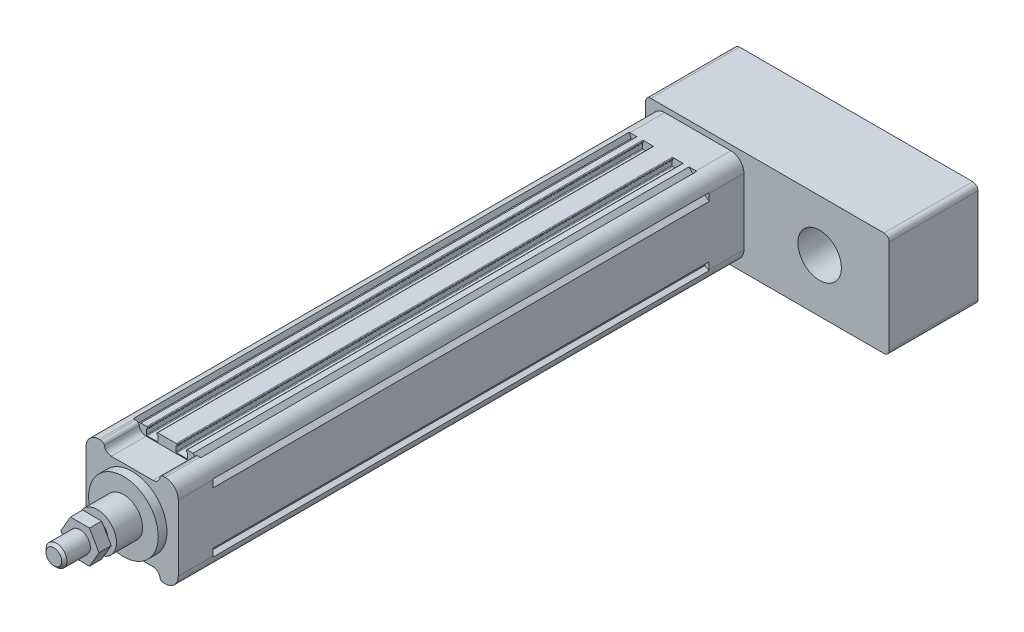
from build123d import *

# Parameters (mm, degrees)
SKETCH_1_R                  = 2.1
EXTRUDE_1_DEPTH             = 285
EXTRUDE_2_DEPTH             = 20
SKETCH_7_R                  = 20
EXTRUDE_3_DEPTH             = 5
SKETCH_9_R                  = 11
EXTRUDE_4_DEPTH             = 15
SKETCH_10_R                 = 6
EXTRUDE_5_DEPTH             = 25
EXTRUDE_START               = 20
EXTRUDE_6_DEPTH             = 20
EXTRUDE_7_DEPTH             = 51
SKETCH_13_R                 = 12.5
CUT_EXTRUDE_2_DEPTH         = 30
PATTERN_LINEAR_1_COUNT      = 2
PATTERN_LINEAR_1_PITCH      = 38
PATTERN_LINEAR_1_COUNT_DIR2 = 2
PATTERN_LINEAR_1_PITCH_DIR2 = 38
HOLE_WIZARD_M6_2_D          = 5
HOLE_WIZARD_M6_2_DEPTH      = 15
HOLE_WIZARD_M6_2_TIP        = 1.502151548
HOLE_WIZARD_M6_3_D          = 5
HOLE_WIZARD_M6_3_DEPTH      = 15
HOLE_WIZARD_M6_3_TIP        = 1.502151548
HOLE_WIZARD_M6_4_D          = 5
HOLE_WIZARD_M6_4_DEPTH      = 15
HOLE_WIZARD_M6_4_TIP        = 1.502151548
CHAMFER_1_SIZE              = 1.5
EXTRUDE_START_2             = 3
EXTRUDE_8_DEPTH             = 7


with BuildPart() as part:
    # 草图1 → 凸台-拉伸1 (new body)
    with BuildSketch(Plane.XY):
        with BuildLine():
            Line((-18.2, 24), (-19.443439638, 26.486879276))
            ThreePointArc((-19.443439638, 26.486879276), (-24.303300859, 24.303300859), (-26.486879276, 19.443439638))
            Line((-26.486879276, 19.443439638), (-24, 18.2))
            Line((-24, 18.2), (-24, 17.1))
            Line((-24, 17.1), (-26.5, 15))
            Line((-26.5, 15), (-26.5, -15))
            Line((-26.5, -15), (-24, -17.1))
            Line((-24, -17.1), (-24, -18.2))
            Line((-24, -18.2), (-26.486879276, -19.443439638))
            ThreePointArc((-26.486879276, -19.443439638), (-24.303300859, -24.303300859), (-19.443439638, -26.486879276))
            Line((-19.443439638, -26.486879276), (-18.2, -24))
            Line((-18.2, -24), (-17.1, -24))
            Line((-17.1, -24), (-15, -26.5))
            Line((-15, -26.5), (-11.65, -26.5))
            ThreePointArc((-11.65, -26.5), (-11.367157288, -26.382842712), (-11.25, -26.1))
            Line((-11.25, -26.1), (-11.25, -25.6))
            ThreePointArc((-11.25, -25.6), (-11.367157288, -25.317157288), (-11.65, -25.2))
            Line((-11.65, -25.2), (-11.75, -25.2))
            Line((-11.75, -25.2), (-11.75, -22.4))
            ThreePointArc((-11.75, -22.4), (-11.632842712, -22.117157288), (-11.35, -22))
            Line((-11.35, -22), (-5.65, -22))
            ThreePointArc((-5.65, -22), (-5.367157288, -22.117157288), (-5.25, -22.4))
            Line((-5.25, -22.4), (-5.25, -25.2))
            Line((-5.25, -25.2), (-5.35, -25.2))
            ThreePointArc((-5.35, -25.2), (-5.632842712, -25.317157288), (-5.75, -25.6))
            Line((-5.75, -25.6), (-5.75, -26.1))
            ThreePointArc((-5.75, -26.1), (-5.632842712, -26.382842712), (-5.35, -26.5))
            Line((-5.35, -26.5), (5.35, -26.5))
            ThreePointArc((5.35, -26.5), (5.632842712, -26.382842712), (5.75, -26.1))
            Line((5.75, -26.1), (5.75, -25.6))
            ThreePointArc((5.75, -25.6), (5.632842712, -25.317157288), (5.35, -25.2))
            Line((5.35, -25.2), (5.25, -25.2))
            Line((5.25, -25.2), (5.25, -22.4))
            ThreePointArc((5.25, -22.4), (5.367157288, -22.117157288), (5.65, -22))
            Line((5.65, -22), (11.35, -22))
            ThreePointArc((11.35, -22), (11.632842712, -22.117157288), (11.75, -22.4))
            Line((11.75, -22.4), (11.75, -25.2))
            Line((11.75, -25.2), (11.65, -25.2))
            ThreePointArc((11.65, -25.2), (11.367157288, -25.317157288), (11.25, -25.6))
            Line((11.25, -25.6), (11.25, -26.1))
            ThreePointArc((11.25, -26.1), (11.367157288, -26.382842712), (11.65, -26.5))
            Line((11.65, -26.5), (15, -26.5))
            Line((15, -26.5), (17.1, -24))
            Line((17.1, -24), (18.2, -24))
            Line((18.2, -24), (19.443439638, -26.486879276))
            ThreePointArc((19.443439638, -26.486879276), (24.303300859, -24.303300859), (26.486879276, -19.443439638))
            Line((26.486879276, -19.443439638), (24, -18.2))
            Line((24, -18.2), (24, -17.1))
            Line((24, -17.1), (26.5, -15))
            Line((26.5, -15), (26.5, 15))
            Line((26.5, 15), (24, 17.1))
            Line((24, 17.1), (24, 18.2))
            Line((24, 18.2), (26.486879276, 19.443439638))
            ThreePointArc((26.486879276, 19.443439638), (24.303300859, 24.303300859), (19.443439638, 26.486879276))
            Line((19.443439638, 26.486879276), (18.2, 24))
            Line((18.2, 24), (17.1, 24))
            Line((17.1, 24), (15, 26.5))
            Line((15, 26.5), (11.65, 26.5))
            ThreePointArc((11.65, 26.5), (11.367157288, 26.382842712), (11.25, 26.1))
            Line((11.25, 26.1), (11.25, 25.6))
            ThreePointArc((11.25, 25.6), (11.367157288, 25.317157288), (11.65, 25.2))
            Line((11.65, 25.2), (11.75, 25.2))
            Line((11.75, 25.2), (11.75, 22.4))
            ThreePointArc((11.75, 22.4), (11.632842712, 22.117157288), (11.35, 22))
            Line((11.35, 22), (5.65, 22))
            ThreePointArc((5.65, 22), (5.367157288, 22.117157288), (5.25, 22.4))
            Line((5.25, 22.4), (5.25, 25.2))
            Line((5.25, 25.2), (5.35, 25.2))
            ThreePointArc((5.35, 25.2), (5.632842712, 25.317157288), (5.75, 25.6))
            Line((5.75, 25.6), (5.75, 26.1))
            ThreePointArc((5.75, 26.1), (5.632842712, 26.382842712), (5.35, 26.5))
            Line((5.35, 26.5), (-5.35, 26.5))
            ThreePointArc((-5.35, 26.5), (-5.632842712, 26.382842712), (-5.75, 26.1))
            Line((-5.75, 26.1), (-5.75, 25.6))
            ThreePointArc((-5.75, 25.6), (-5.632842712, 25.317157288), (-5.35, 25.2))
            Line((-5.35, 25.2), (-5.25, 25.2))
            Line((-5.25, 25.2), (-5.25, 22.4))
            ThreePointArc((-5.25, 22.4), (-5.367157288, 22.117157288), (-5.65, 22))
            Line((-5.65, 22), (-11.35, 22))
            ThreePointArc((-11.35, 22), (-11.632842712, 22.117157288), (-11.75, 22.4))
            Line((-11.75, 22.4), (-11.75, 25.2))
            Line((-11.75, 25.2), (-11.65, 25.2))
            ThreePointArc((-11.65, 25.2), (-11.367157288, 25.317157288), (-11.25, 25.6))
            Line((-11.25, 25.6), (-11.25, 26.1))
            ThreePointArc((-11.25, 26.1), (-11.367157288, 26.382842712), (-11.65, 26.5))
            Line((-11.65, 26.5), (-15, 26.5))
            Line((-15, 26.5), (-17.1, 24))
            Line((-17.1, 24), (-18.2, 24))
        make_face()
        with Locations((19, 19)):
            Circle(SKETCH_1_R, mode=Mode.SUBTRACT)
        with Locations((19, -19)):
            Circle(SKETCH_1_R, mode=Mode.SUBTRACT)
        with Locations((-19, -19)):
            Circle(SKETCH_1_R, mode=Mode.SUBTRACT)
        with Locations((-19, 19)):
            Circle(SKETCH_1_R, mode=Mode.SUBTRACT)
        with BuildLine():
            Line((19.773719933, 3), (23.3, 3))
            Line((23.3, 3), (23.3, -3))
            Line((23.3, -3), (19.773719933, -3))
            ThreePointArc((19.773719933, -3), (0, -20), (-19.773719933, -3))
            Line((-19.773719933, -3), (-23.3, -3))
            Line((-23.3, -3), (-23.3, 3))
            Line((-23.3, 3), (-19.773719933, 3))
            ThreePointArc((-19.773719933, 3), (0, 20), (19.773719933, 3))
        make_face(mode=Mode.SUBTRACT)
    extrude(amount=EXTRUDE_1_DEPTH)

    # 草图6 → 凸台-拉伸2 (add)
    with BuildSketch(Plane.XY.offset(285)):
        with BuildLine():
            Line((-26.5, -19), (-26.5, 19))
            ThreePointArc((-26.5, 19), (-24.303300859, 24.303300859), (-19, 26.5))
            Line((-19, 26.5), (-17.916079783, 26.5))
            ThreePointArc((-17.916079783, 26.5), (-16.625085334, 26.027525232), (-15.944053189, 24.833333333))
            ThreePointArc((-15.944053189, 24.833333333), (-14.581988897, 22.444949537), (-12, 21.5))
            Line((-12, 21.5), (12, 21.5))
            ThreePointArc((12, 21.5), (14.581988897, 22.444949537), (15.944053189, 24.833333333))
            ThreePointArc((15.944053189, 24.833333333), (16.625085334, 26.027525232), (17.916079783, 26.5))
            Line((17.916079783, 26.5), (19, 26.5))
            ThreePointArc((19, 26.5), (24.303300859, 24.303300859), (26.5, 19))
            Line((26.5, 19), (26.5, -19))
            ThreePointArc((26.5, -19), (24.303300859, -24.303300859), (19, -26.5))
            Line((19, -26.5), (17.916079783, -26.5))
            ThreePointArc((17.916079783, -26.5), (16.625085334, -26.027525232), (15.944053189, -24.833333333))
            ThreePointArc((15.944053189, -24.833333333), (14.581988897, -22.444949537), (12, -21.5))
            Line((12, -21.5), (-12, -21.5))
            ThreePointArc((-12, -21.5), (-14.581988897, -22.444949537), (-15.944053189, -24.833333333))
            ThreePointArc((-15.944053189, -24.833333333), (-16.625085334, -26.027525232), (-17.916079783, -26.5))
            Line((-17.916079783, -26.5), (-19, -26.5))
            ThreePointArc((-19, -26.5), (-24.303300859, -24.303300859), (-26.5, -19))
        make_face()
    extrude(amount=EXTRUDE_2_DEPTH)

    # 草图7 → 凸台-拉伸3 (add)
    with BuildSketch(Plane.XY.offset(305)):
        Circle(SKETCH_7_R)
    extrude(amount=EXTRUDE_3_DEPTH)

    # 草图9 → 凸台-拉伸4 (add)
    with BuildSketch(Plane.XY.offset(310)):
        Circle(SKETCH_9_R)
    extrude(amount=EXTRUDE_4_DEPTH)

    # 草图10 → 凸台-拉伸5 (add)
    with BuildSketch(Plane.XY.offset(325)):
        Circle(SKETCH_10_R)
    extrude(amount=EXTRUDE_5_DEPTH)

    # 草图11 → 凸台-拉伸6 (add)
    with BuildSketch(Plane(origin=(0, 0, 0), x_dir=(-1, 0, 0), z_dir=(0, 0, -1)).offset(EXTRUDE_START)):
        with BuildLine():
            Line((-19, -26.5), (19, -26.5))
            ThreePointArc((19, -26.5), (24.303300859, -24.303300859), (26.5, -19))
            Line((26.5, -19), (26.5, 19))
            ThreePointArc((26.5, 19), (24.303300859, 24.303300859), (19, 26.5))
            Line((19, 26.5), (-19, 26.5))
            ThreePointArc((-19, 26.5), (-24.303300859, 24.303300859), (-26.5, 19))
            Line((-26.5, 19), (-26.5, -19))
            ThreePointArc((-26.5, -19), (-24.303300859, -24.303300859), (-19, -26.5))
        make_face()
    extrude(amount=-EXTRUDE_6_DEPTH)

    # 草图12 → 凸台-拉伸7 (add)
    with BuildSketch(Plane(origin=(0, 0, -20), x_dir=(-1, 0, 0), z_dir=(0, 0, -1))):
        with BuildLine():
            Line((-107, -30.404162038), (27, -30.404162038))
            ThreePointArc((27, -30.404162038), (29.121320344, -29.525482382), (30, -27.404162038))
            Line((30, -27.404162038), (30, 26.595837962))
            ThreePointArc((30, 26.595837962), (29.121320344, 28.717158305), (27, 29.595837962))
            Line((27, 29.595837962), (-107, 29.595837962))
            ThreePointArc((-107, 29.595837962), (-109.121320344, 28.717158305), (-110, 26.595837962))
            Line((-110, 26.595837962), (-110, -27.404162038))
            ThreePointArc((-110, -27.404162038), (-109.121320344, -29.525482382), (-107, -30.404162038))
        make_face()
    extrude(amount=EXTRUDE_7_DEPTH)

    # 草图13 → 切除-拉伸2 (cut)
    with BuildSketch(Plane.XY.offset(-20)):
        with Locations((70, 0)):
            Circle(SKETCH_13_R)
    extrude(amount=-CUT_EXTRUDE_2_DEPTH, mode=Mode.SUBTRACT)

    # 草图15 → M6 螺纹孔1 (revolve, cut)
    with BuildSketch(Plane(origin=(-19, -19, -71), x_dir=(0, 1, 0), z_dir=(1, 0, 0))):
        Polygon((0, 0), (0, 16.502151548), (2.5, 15), (2.5, 0), align=None)
    hole_wizard_m6_1 = revolve(axis=Axis((-19, -19, -77.35), (0, 0, 1)), mode=Mode.SUBTRACT)

    # 阵列(线性)1: Hole Wizard M6 _1 2 × 2
    with Locations(*[(j * PATTERN_LINEAR_1_PITCH_DIR2, i * PATTERN_LINEAR_1_PITCH, 0) for i in range(PATTERN_LINEAR_1_COUNT) for j in range(PATTERN_LINEAR_1_COUNT_DIR2) if (i, j) != (0, 0)]):
        add(hole_wizard_m6_1, mode=Mode.SUBTRACT)

    # M6 螺纹孔2
    with Locations(Plane(origin=(0, 0, -71), x_dir=(-1, 0, 0), z_dir=(0, 0, -1))):
        with Locations((-84, -19), (-84, 19)):
            Hole(HOLE_WIZARD_M6_2_D / 2, depth=HOLE_WIZARD_M6_2_DEPTH)
            with Locations((0, 0, -(HOLE_WIZARD_M6_2_DEPTH + HOLE_WIZARD_M6_2_TIP / 2))):  # 118° drill point
                Cone(0, HOLE_WIZARD_M6_2_D / 2, HOLE_WIZARD_M6_2_TIP, mode=Mode.SUBTRACT)

    # M6 螺纹孔3
    with Locations(Plane.ZY.offset(26.5)):
        with Locations((295, 11), (295, -11)):
            Hole(HOLE_WIZARD_M6_3_D / 2, depth=HOLE_WIZARD_M6_3_DEPTH)
            with Locations((0, 0, -(HOLE_WIZARD_M6_3_DEPTH + HOLE_WIZARD_M6_3_TIP / 2))):  # 118° drill point
                Cone(0, HOLE_WIZARD_M6_3_D / 2, HOLE_WIZARD_M6_3_TIP, mode=Mode.SUBTRACT)

    # M6 螺纹孔4
    with Locations(Plane.ZY.offset(26.5)):
        with Locations((-10, 11), (-10, -11)):
            Hole(HOLE_WIZARD_M6_4_D / 2, depth=HOLE_WIZARD_M6_4_DEPTH)
            with Locations((0, 0, -(HOLE_WIZARD_M6_4_DEPTH + HOLE_WIZARD_M6_4_TIP / 2))):  # 118° drill point
                Cone(0, HOLE_WIZARD_M6_4_D / 2, HOLE_WIZARD_M6_4_TIP, mode=Mode.SUBTRACT)

    # 倒角1
    chamfer_1_edges = [part.edges().sort_by_distance(p)[0] for p in [
        (-6, 0, 350),
    ]]
    chamfer(chamfer_1_edges, length=CHAMFER_1_SIZE)

    # 草图23 → 凸台-拉伸8 (add)
    with BuildSketch(Plane.XY.offset(325).offset(EXTRUDE_START_2)):
        Polygon((10.969655115, 0), (5.484827557, 9.5), (-5.484827557, 9.5), (-10.969655115, 0), (-5.484827557, -9.5), (5.484827557, -9.5), align=None)
    extrude(amount=EXTRUDE_8_DEPTH)


solid = part.part
